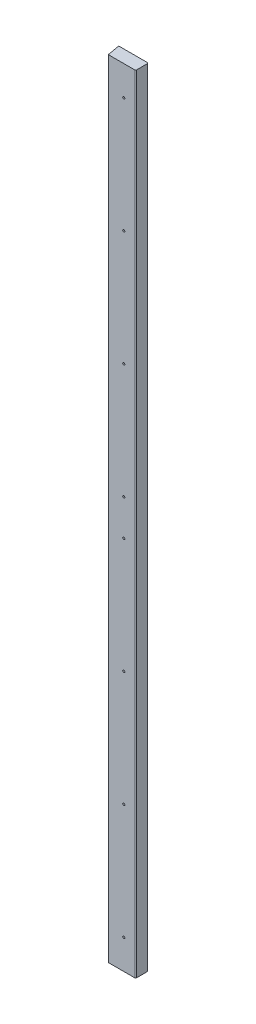
from build123d import *

# Parameters (mm, degrees)
BOSS_EXTRUDE1_DEPTH         = 2362.2
F_1_4_0_25_DIAMETER_HOLE1_D = 6.35
FILLET2_R                   = 3.175


with BuildPart() as part:
    # Sketch1 → Boss-Extrude1 (new body)
    with BuildSketch(Plane(origin=(0, 0, 0), x_dir=(1, 0, 0), z_dir=(0, 1, 0))):
        Polygon((-44.45, 19.05), (-37.731942035, -19.05), (44.45, -19.05), (44.45, 19.05), align=None)
    extrude(amount=BOSS_EXTRUDE1_DEPTH)

    # 1/4 (0.25) Diameter Hole1 (through all)
    with Locations(Plane(origin=(0, 0, 19.05), x_dir=(-1, 0, 0), z_dir=(0, 0, 1))):
        with Locations((-8.817444165, -88.9), (-8.817444165, -434.975), (-8.817444165, -781.05), (-8.817444165, -1127.125)):
            f_1_4_0_25_diameter_hole1 = Hole(F_1_4_0_25_DIAMETER_HOLE1_D / 2)

    # Fillet2
    fillet2_edges = [part.edges().sort_by_distance(p)[0] for p in [
        (44.45, 1181.1, 19.05),
        (44.45, 1181.1, -19.05),
    ]]
    fillet(fillet2_edges, radius=FILLET2_R)

    # Mirror1: 1/4 (0.25) Diameter Hole1 across plane
    add(f_1_4_0_25_diameter_hole1.mirror(Plane(origin=(0, 1181.1, 0), x_dir=(0, 0, 1), z_dir=(0, -1, 0))), mode=Mode.SUBTRACT)


solid = part.part
